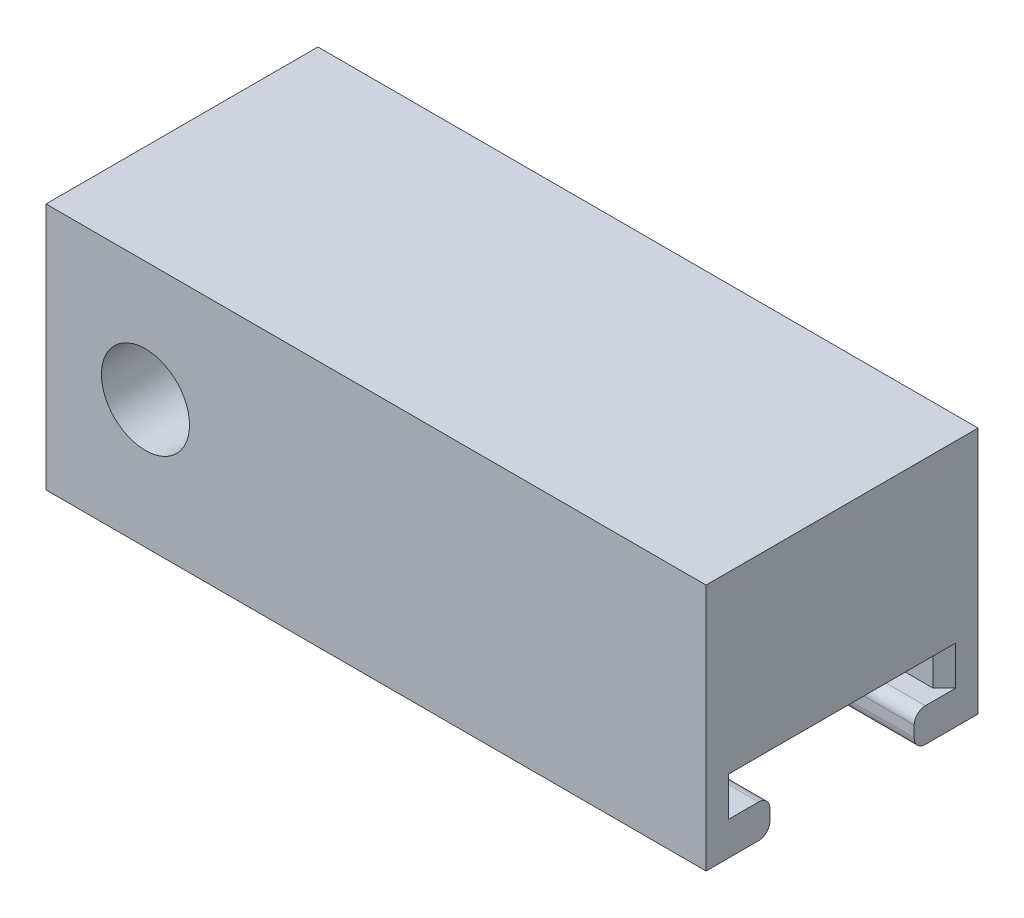
from build123d import *

# Parameters (mm, degrees)
BOSS_EXTRUDE1_DEPTH      = 59
SKETCH2_W                = 59
SKETCH2_H                = 3.5
BOSS_EXTRUDE2_DEPTH      = 1
CHAMFER1_SIZE            = 1
CHAMFER1_OF_MIRROR3_SIZE = 1
BOSS_EXTRUDE3_DEPTH      = 3
SKETCH4_W                = 59
SKETCH4_H                = 24.303864374
BOSS_EXTRUDE4_DEPTH      = 12.7
CUT_EXTRUDE1_DEPTH       = 6.096
SKETCH8_R                = 3.937
CUT_EXTRUDE2_DEPTH       = 11.43
CUT_EXTRUDE3_DEPTH       = 25.4


with BuildPart() as part:
    # Sketch1 → Boss-Extrude1 (new body)
    with BuildSketch(Plane(origin=(0, 0, 0), x_dir=(0, 0, -1), z_dir=(1, 0, 0))):
        with BuildLine():
            Line((12.151932187, 0), (12.148068004, -9.437434945))
            Line((12.148068004, -9.437434945), (7.448068195, -9.437434945))
            ThreePointArc((7.448068195, -9.437434945), (6.740961414, -9.144541726), (6.448068195, -8.437434945))
            Line((6.448068195, -8.437434945), (6.448068195, -7.437434945))
            ThreePointArc((6.448068195, -7.437434945), (6.740961414, -6.730328164), (7.448068195, -6.437434945))
            Line((7.448068195, -6.437434945), (10.148068004, -6.437434945))
            Line((10.148068004, -6.437434945), (10.148068004, -2.937434945))
            Line((10.148068004, -2.937434945), (-10.151932187, -2.937434945))
            Line((-10.151932187, -2.937434945), (-10.151932187, -6.437434945))
            Line((-10.151932187, -6.437434945), (-7.451931901, -6.437434945))
            ThreePointArc((-7.451931901, -6.437434945), (-6.744825119, -6.730328164), (-6.451931901, -7.437434945))
            Line((-6.451931901, -7.437434945), (-6.451931901, -8.437434945))
            ThreePointArc((-6.451931901, -8.437434945), (-6.744825119, -9.144541727), (-7.451931901, -9.437434945))
            Line((-7.451931901, -9.437434945), (-12.151932187, -9.437434945))
            Line((-12.151932187, -9.437434945), (-12.151932187, 0))
            Line((-12.151932187, 0), (12.151932187, 0))
        make_face()
    extrude(amount=BOSS_EXTRUDE1_DEPTH)

    # Sketch2 → Boss-Extrude2 (add)
    with BuildSketch(Plane(origin=(0, 0, 10.151932187), x_dir=(-1, 0, 0), z_dir=(0, 0, -1))):
        with Locations((-29.5, -4.687434945)):
            Rectangle(SKETCH2_W, SKETCH2_H)
    boss_extrude2 = extrude(amount=BOSS_EXTRUDE2_DEPTH)

    # Chamfer1
    chamfer1_edges = [part.edges().sort_by_distance(p)[0] for p in [
        (59, -4.687434945, 9.151932187),
    ]]
    chamfer(chamfer1_edges, length=CHAMFER1_SIZE)

    # Mirror3: Boss-Extrude2 across plane
    add(boss_extrude2.mirror(Plane.XY))

    # Chamfer1 of Mirror3
    chamfer1_of_mirror3_edges = [part.edges().sort_by_distance(p)[0] for p in [
        (59, -4.687434945, -9.151932187),
    ]]
    chamfer(chamfer1_of_mirror3_edges, length=CHAMFER1_OF_MIRROR3_SIZE)

    # Sketch4 → Boss-Extrude4 (add)
    with BuildSketch(Plane(origin=(0, 0, 0), x_dir=(1, 0, 0), z_dir=(0, 1, 0))):
        with Locations((29.5, 0)):
            Rectangle(SKETCH4_W, SKETCH4_H)
    extrude(amount=BOSS_EXTRUDE4_DEPTH)

    # Sketch5 → Cut-Extrude1 (cut)
    with BuildSketch(Plane(origin=(0, 0, -12.151932187), x_dir=(-1, 0, 0), z_dir=(0, 0, -1))):
        with BuildLine():
            Line((-6.840609847, 3.596945044), (-10.939390153, 3.596945044))
            ThreePointArc((-10.939390153, 3.596945044), (-11.49, 1.996945044), (-10.939390153, 0.396945044))
            Line((-10.939390153, 0.396945044), (-6.840609847, 0.396945044))
            ThreePointArc((-6.840609847, 0.396945044), (-6.29, 1.996945044), (-6.840609847, 3.596945044))
        make_face()
    extrude(amount=-CUT_EXTRUDE1_DEPTH, mode=Mode.SUBTRACT)

    # Sketch8 → Cut-Extrude2 (cut)
    with BuildSketch(Plane.XY.offset(12.151932187)):
        with Locations((8.89, 1.996945044)):
            Circle(SKETCH8_R)
    extrude(amount=-CUT_EXTRUDE2_DEPTH, mode=Mode.SUBTRACT)

    # Sketch9 → Cut-Extrude3 (cut)
    with BuildSketch(Plane.ZY):
        with BuildLine():
            Line((-9.151932187, -6.437434945), (-9.151932187, -9.437434945))
            Line((-9.151932187, -9.437434945), (-7.448068195, -9.437434945))
            ThreePointArc((-7.448068195, -9.437434945), (-6.740961414, -9.144541726), (-6.448068195, -8.437434945))
            Line((-6.448068195, -8.437434945), (-6.448068195, -7.437434945))
            ThreePointArc((-6.448068195, -7.437434945), (-6.740961414, -6.730328164), (-7.448068195, -6.437434945))
            Line((-7.448068195, -6.437434945), (-9.151932187, -6.437434945))
        make_face()
        with BuildLine():
            Line((9.151932187, -9.437434945), (7.448068195, -9.437434945))
            ThreePointArc((7.448068195, -9.437434945), (6.740961414, -9.144541726), (6.448068195, -8.437434945))
            Line((6.448068195, -8.437434945), (6.448068195, -7.437434945))
            ThreePointArc((6.448068195, -7.437434945), (6.740961414, -6.730328164), (7.448068195, -6.437434945))
            Line((7.448068195, -6.437434945), (9.151932187, -6.437434945))
            Line((9.151932187, -6.437434945), (9.151932187, -9.437434945))
        make_face()
    extrude(amount=-CUT_EXTRUDE3_DEPTH, mode=Mode.SUBTRACT)


with BuildPart() as body_2:
    # Sketch3 → Boss-Extrude3 (new, symmetric)
    with BuildSketch(Plane(origin=(9.151932187, 0, 0), x_dir=(-1, 0, 0), z_dir=(0, 0, -1))):
        with BuildLine():
            Line((0.623772187, -2.937434945), (-4.319907813, -2.937434945))
            ThreePointArc((-4.319907813, -2.937434945), (-1.848067813, -3.961304597), (0.623772187, -2.937434945))
        make_face()
    extrude(amount=BOSS_EXTRUDE3_DEPTH, both=True)


solid = Compound([part.part, body_2.part])
